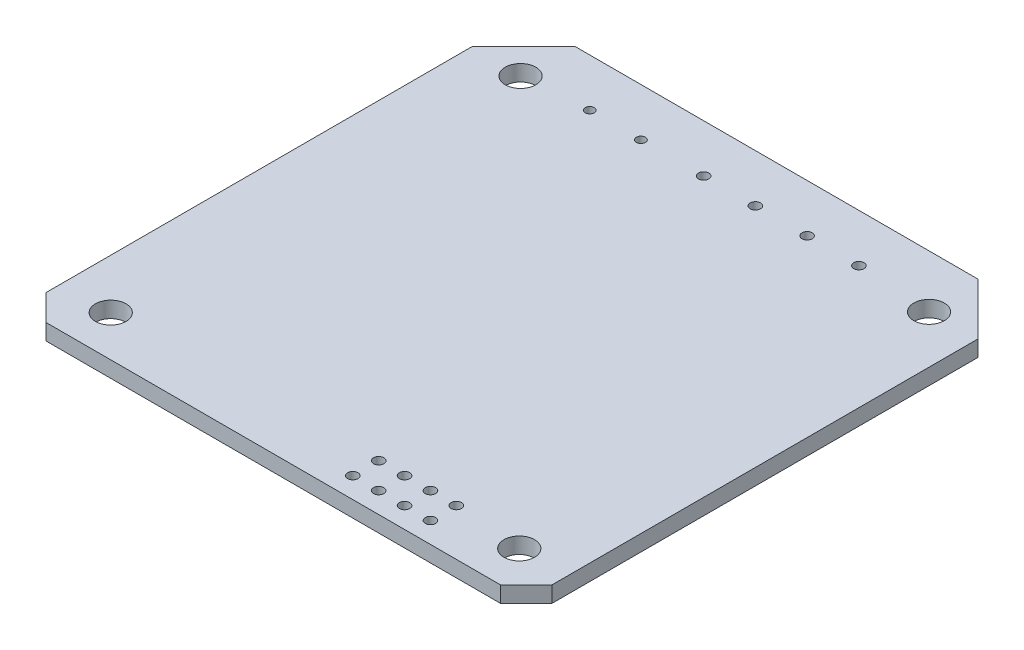
from build123d import *

# Parameters (mm, degrees)
SKETCH1_W           = 49.657
SKETCH1_H           = 49.403
BOSS_EXTRUDE1_DEPTH = 1.5748
CHAMFER1_SIZE       = 5.08
CHAMFER2_SIZE       = 2.54
SKETCH2_R           = 1.5
SKETCH2_R_2         = 0.508
CUT_EXTRUDE1_DEPTH  = 36.058501245
SKETCH3_R           = 0.508
SKETCH3_R_2         = 0.4445
CUT_EXTRUDE2_DEPTH  = 2.54


with BuildPart() as part:
    # Sketch1 → Boss-Extrude1 (new body)
    with BuildSketch(Plane(origin=(0, 0, 0), x_dir=(1, 0, 0), z_dir=(0, 1, 0))):
        Rectangle(SKETCH1_W, SKETCH1_H)
    extrude(amount=BOSS_EXTRUDE1_DEPTH)

    # Chamfer1
    chamfer1_edges = [part.edges().sort_by_distance(p)[0] for p in [
        (-24.8285, 0.7874, -24.7015),
        (24.8285, 0.7874, -24.7015),
    ]]
    chamfer(chamfer1_edges, length=CHAMFER1_SIZE)

    # Chamfer2
    chamfer2_edges = [part.edges().sort_by_distance(p)[0] for p in [
        (24.8285, 0.7874, 24.7015),
        (-24.8285, 0.7874, 24.7015),
    ]]
    chamfer(chamfer2_edges, length=CHAMFER2_SIZE)

    # Sketch2 → Cut-Extrude1 (cut, through all)
    with BuildSketch(Plane(origin=(0, 1.5748, 0), x_dir=(1, 0, 0), z_dir=(0, 1, 0))):
        with Locations((-19.9517, -20.6883)):
            Circle(SKETCH2_R)
        with Locations((20.1295, -20.6883)):
            Circle(SKETCH2_R)
        with Locations((-19.9517, 19.5199)):
            Circle(SKETCH2_R)
        with Locations((20.1295, 19.5199)):
            Circle(SKETCH2_R)
        with Locations((5.7785, -22.6695)):
            Circle(SKETCH2_R_2)
        with Locations((8.3185, -22.6695)):
            Circle(SKETCH2_R_2)
        with Locations((10.8585, -22.6695)):
            Circle(SKETCH2_R_2)
        with Locations((13.3985, -22.6695)):
            Circle(SKETCH2_R_2)
        with Locations((8.3185, -20.1295)):
            Circle(SKETCH2_R_2)
        with Locations((10.8585, -20.1295)):
            Circle(SKETCH2_R_2)
        with Locations((13.3985, -20.1295)):
            Circle(SKETCH2_R_2)
        with Locations((5.7785, -20.1295)):
            Circle(SKETCH2_R_2)
    extrude(amount=-CUT_EXTRUDE1_DEPTH, mode=Mode.SUBTRACT)

    # Sketch3 → Cut-Extrude2 (cut)
    with BuildSketch(Plane(origin=(0, 1.5748, 0), x_dir=(1, 0, 0), z_dir=(0, 1, 0))):
        with Locations((12.7635, 20.0025)):
            Circle(SKETCH3_R)
        with Locations((7.6835, 20.0025)):
            Circle(SKETCH3_R)
        with Locations((2.6035, 20.0025)):
            Circle(SKETCH3_R)
        with Locations((-2.4765, 20.0025)):
            Circle(SKETCH3_R)
        with Locations((-8.6233, 20.0025)):
            Circle(SKETCH3_R_2)
        with Locations((-13.65137741, 20.0025)):
            Circle(SKETCH3_R_2)
    extrude(amount=-CUT_EXTRUDE2_DEPTH, mode=Mode.SUBTRACT)


solid = part.part
